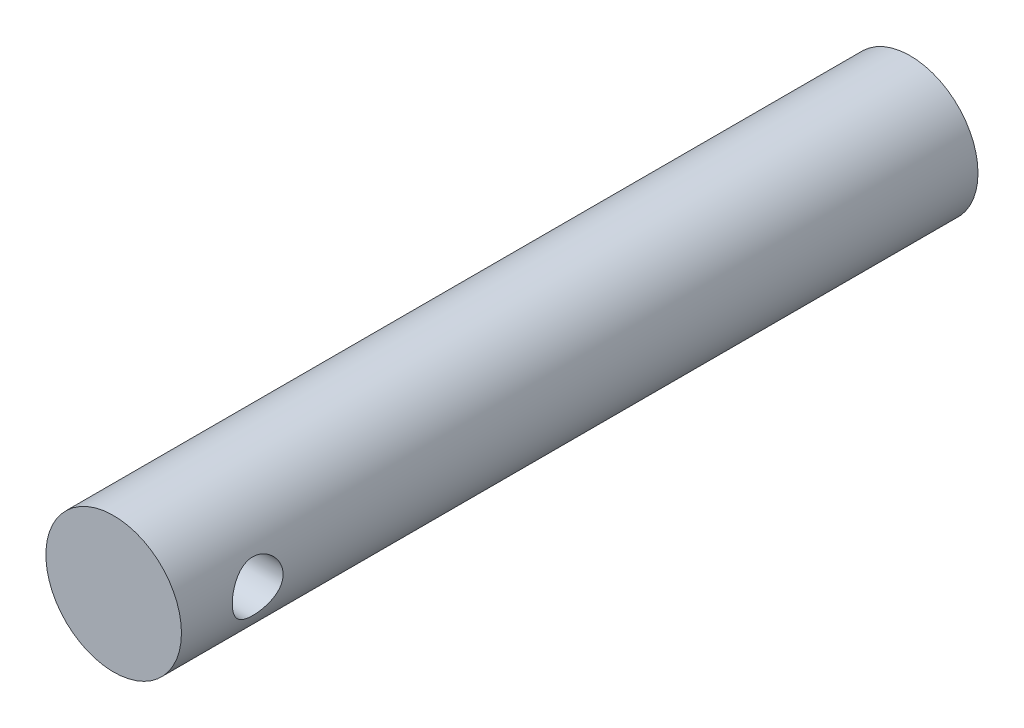
from build123d import *

# Parameters (mm, degrees)
SKETCH1_R           = 4
BOSS_EXTRUDE1_DEPTH = 47
SKETCH2_R           = 1.5
CUT_EXTRUDE1_DEPTH  = 48.843494856


with BuildPart() as part:
    # Sketch1 → Boss-Extrude1 (new body)
    with BuildSketch(Plane.XY):
        Circle(SKETCH1_R)
    extrude(amount=BOSS_EXTRUDE1_DEPTH)

    # Sketch2 → Cut-Extrude1 (cut, through all)
    with BuildSketch(Plane(origin=(4, 0, 0), x_dir=(0, 0, -1), z_dir=(1, 0, 0))):
        with Locations((-42.5, 0)):
            Circle(SKETCH2_R)
    extrude(amount=-CUT_EXTRUDE1_DEPTH, mode=Mode.SUBTRACT)


solid = part.part
